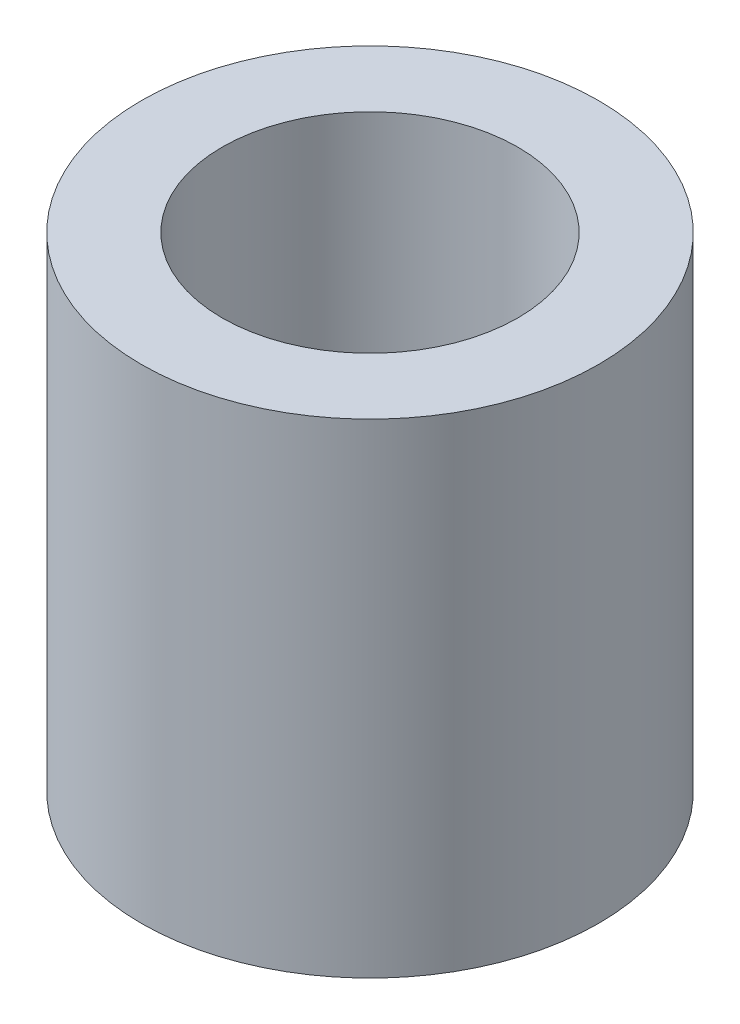
from build123d import *

# Parameters (mm, degrees)
SKETCH1_R           = 4.25
SKETCH1_R_2         = 2.75
BOSS_EXTRUDE1_DEPTH = 9


with BuildPart() as part:
    # Sketch1 → Boss-Extrude1 (new body)
    with BuildSketch(Plane(origin=(0, 0, 0), x_dir=(1, 0, 0), z_dir=(0, 1, 0))):
        Circle(SKETCH1_R)
        Circle(SKETCH1_R_2, mode=Mode.SUBTRACT)
    extrude(amount=BOSS_EXTRUDE1_DEPTH)


solid = part.part
